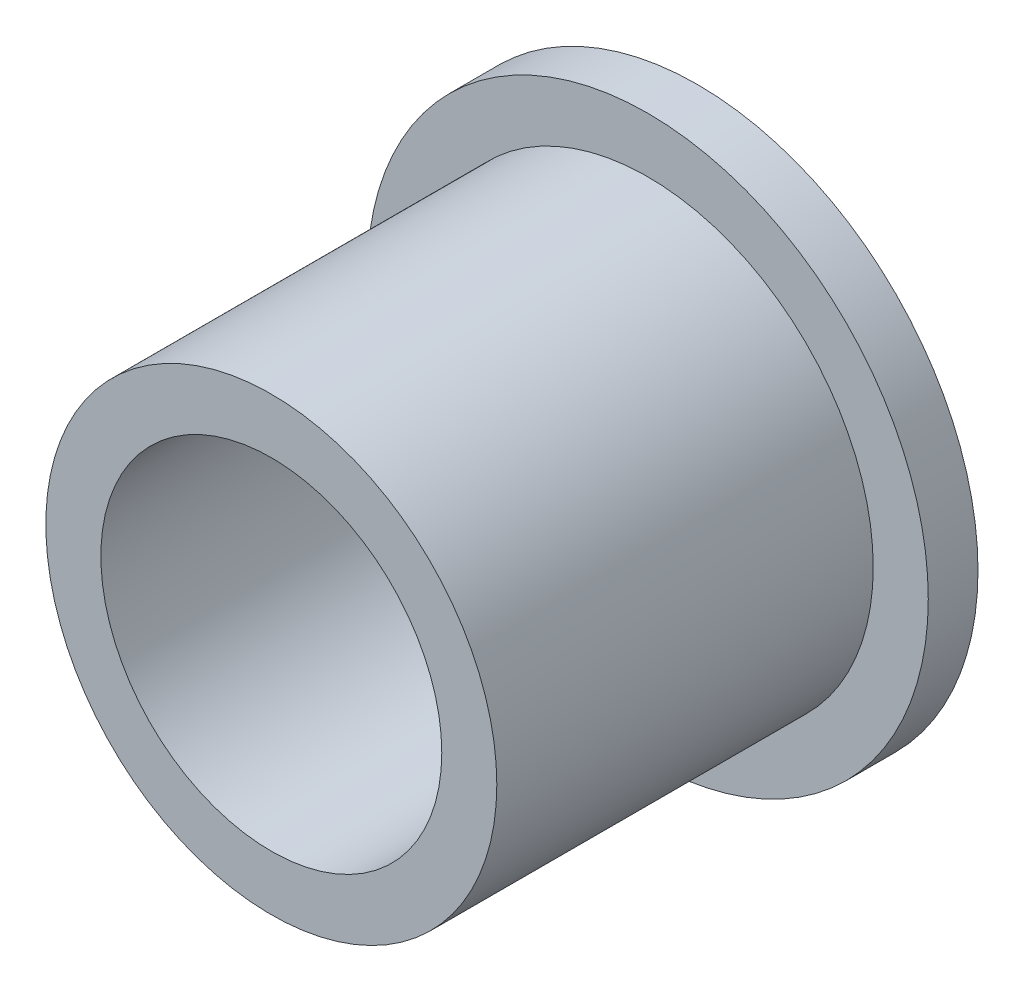
from build123d import *

# Parameters (mm, degrees)
SKETCH1_R           = 7.9
SKETCH1_R_2         = 4.8
BOSS_EXTRUDE1_DEPTH = 12
SKETCH2_R           = 10.145175322
SKETCH2_R_2         = 6.35
CUT_EXTRUDE1_DEPTH  = 10.6


with BuildPart() as part:
    # Sketch1 → Boss-Extrude1 (new body)
    with BuildSketch(Plane.XY):
        Circle(SKETCH1_R)
        Circle(SKETCH1_R_2, mode=Mode.SUBTRACT)
    extrude(amount=BOSS_EXTRUDE1_DEPTH)

    # Sketch2 → Cut-Extrude1 (cut)
    with BuildSketch(Plane.XY.offset(12)):
        Circle(SKETCH2_R)
        Circle(SKETCH2_R_2, mode=Mode.SUBTRACT)
    extrude(amount=-CUT_EXTRUDE1_DEPTH, mode=Mode.SUBTRACT)


solid = part.part
